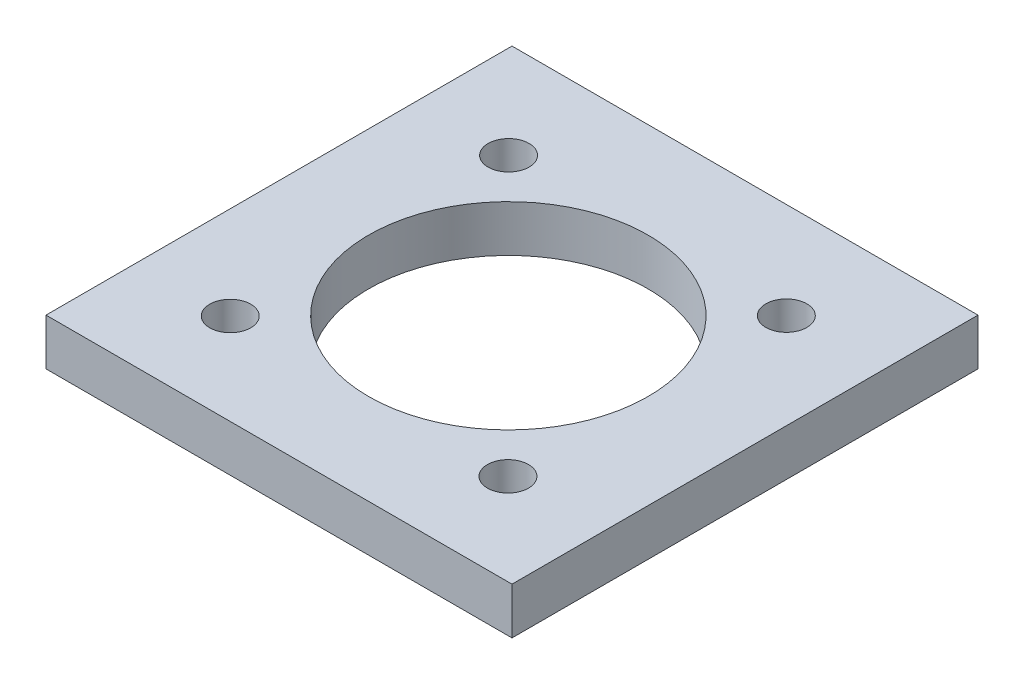
from build123d import *

# Parameters (mm, degrees)
CROQUIS1_W              = 50
CROQUIS1_H              = 50
SALIENTE_EXTRUIR1_DEPTH = 5
CROQUIS2_R              = 15
CROQUIS2_R_2            = 2.2
CORTAR_EXTRUIR1_DEPTH   = 5


with BuildPart() as part:
    # Croquis1 → Saliente-Extruir1 (new body)
    with BuildSketch(Plane(origin=(0, 0, 0), x_dir=(1, 0, 0), z_dir=(0, 1, 0))):
        Rectangle(CROQUIS1_W, CROQUIS1_H)
    extrude(amount=SALIENTE_EXTRUIR1_DEPTH)

    # Croquis2 → Cortar-Extruir1 (cut)
    with BuildSketch(Plane(origin=(0, 5, 0), x_dir=(1, 0, 0), z_dir=(0, 1, 0))):
        with Locations(Location((-0.132800223, -0.260912255, 0), (0, 0, 270))):
            Circle(CROQUIS2_R)
        with Locations(Location((14.767199777, 14.667599609, 0), (0, 0, 270))):
            Circle(CROQUIS2_R_2)
        with Locations(Location((-15.032800223, -15.198800503, 0), (0, 0, 270))):
            Circle(CROQUIS2_R_2)
        with Locations(Location((-15.032800223, 14.667599609, 0), (0, 0, 90))):
            Circle(CROQUIS2_R_2)
        with Locations(Location((14.767199777, -15.198800503, 0), (0, 0, 90))):
            Circle(CROQUIS2_R_2)
    extrude(amount=-CORTAR_EXTRUIR1_DEPTH, mode=Mode.SUBTRACT)


solid = part.part
